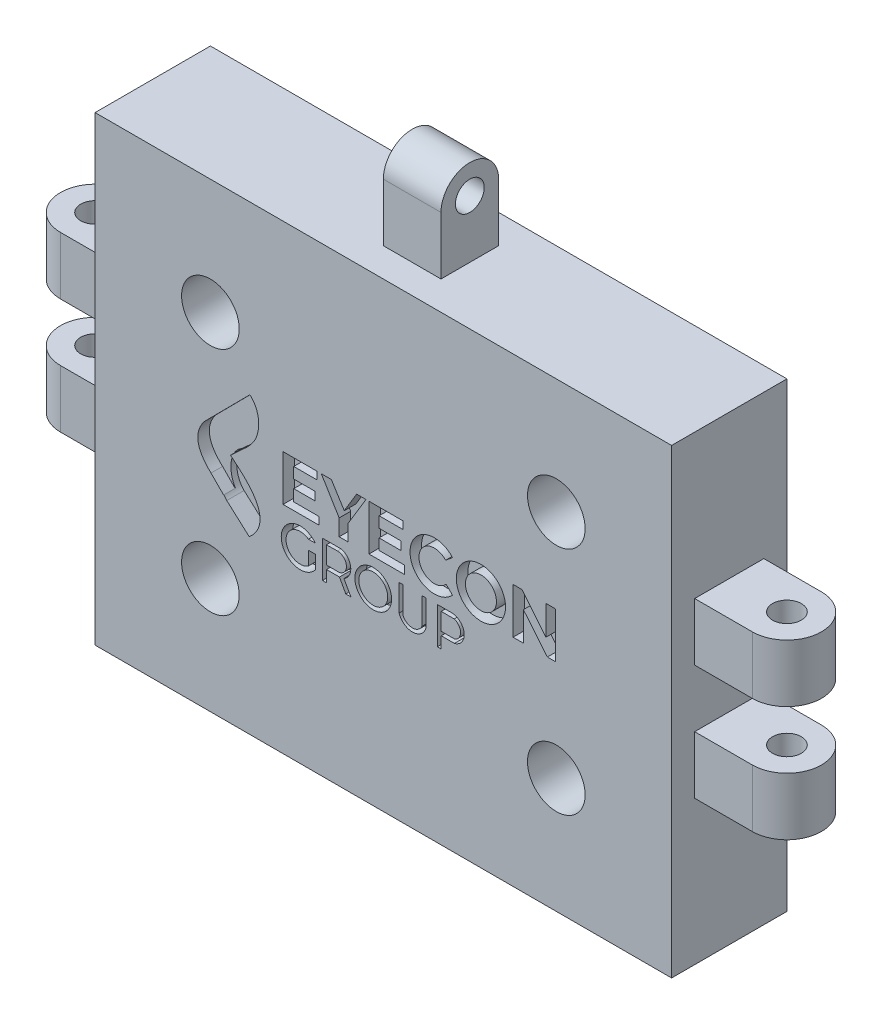
from build123d import *

# Parameters (mm, degrees)
SKETCH1_W           = 50
SKETCH1_H           = 40
BOSS_EXTRUDE1_DEPTH = 10
SKETCH5_W           = 6
SKETCH5_H           = 5
BOSS_EXTRUDE3_DEPTH = 10
SKETCH6_R           = 1.25
CUT_EXTRUDE1_DEPTH  = 20
SKETCH8_W           = 10
SKETCH8_H           = 40
CUT_EXTRUDE2_DEPTH  = 25
SKETCH12_W          = 5
SKETCH12_H          = 5
BOSS_EXTRUDE5_DEPTH = 10
SKETCH13_R          = 1.25
CUT_EXTRUDE4_DEPTH  = 10
SKETCH14_R          = 2.5
CUT_EXTRUDE5_DEPTH  = 10
CUT_EXTRUDE6_DEPTH  = 22
CUT_EXTRUDE7_DEPTH  = 30
CUT_EXTRUDE8_DEPTH  = 30
SCALE1_SCALE        = 2
CUT_EXTRUDE31_DEPTH = 2
SKETCH24_R          = 4.266796814
SKETCH24_R_2        = 2.690088412
CUT_EXTRUDE32_DEPTH = 2
SKETCH25_R          = 3.182411807
SKETCH25_R_2        = 2.505398091
CUT_EXTRUDE33_DEPTH = 2
CUT_EXTRUDE34_DEPTH = 3


with BuildPart() as part:
    # Sketch1 → Boss-Extrude1 (new body)
    with BuildSketch(Plane(origin=(669.84184187, 0, 0), x_dir=(1, 0, 0), z_dir=(0, 0, 1))):
        with Locations((-671.310344828, 437.637931034)):
            Rectangle(SKETCH1_W, SKETCH1_H)
    boss_extrude1 = extrude(amount=BOSS_EXTRUDE1_DEPTH)

    # Sketch5 → Boss-Extrude3 (add)
    with BuildSketch(Plane(origin=(23.531497042, 0, 0), x_dir=(0, 0, -1), z_dir=(1, 0, 0))):
        with Locations((-5, 442.637931034)):
            Rectangle(SKETCH5_W, SKETCH5_H)
        with Locations((-5, 432.637931034)):
            Rectangle(SKETCH5_W, SKETCH5_H)
    boss_extrude3 = extrude(amount=BOSS_EXTRUDE3_DEPTH)

    # Sketch6 → Cut-Extrude1 (cut)
    with BuildSketch(Plane(origin=(669.84184187, 445.137931034, 0), x_dir=(1, 0, 0), z_dir=(0, 1, 0))):
        with Locations(Location((-641.310344828, -5, 0), (0, 0, 180))):
            Circle(SKETCH6_R)
    cut_extrude1 = extrude(amount=-CUT_EXTRUDE1_DEPTH, mode=Mode.SUBTRACT)

    # Sketch8 → Cut-Extrude2 (cut)
    with BuildSketch(Plane.ZY.offset(26.468502958)):
        with Locations((5, 437.637931034)):
            Rectangle(SKETCH8_W, SKETCH8_H)
    extrude(amount=-CUT_EXTRUDE2_DEPTH, mode=Mode.SUBTRACT)

    # Mirror1: Boss-Extrude1, Boss-Extrude3, Cut-Extrude1 across plane
    add(boss_extrude1.mirror(Plane(origin=(-1.468502958, 0, 0), x_dir=(0, 0, 1), z_dir=(1, 0, 0))))
    add(boss_extrude3.mirror(Plane(origin=(-1.468502958, 0, 0), x_dir=(0, 0, 1), z_dir=(1, 0, 0))))
    add(cut_extrude1.mirror(Plane(origin=(-1.468502958, 0, 0), x_dir=(0, 0, 1), z_dir=(1, 0, 0))), mode=Mode.SUBTRACT)

    # Sketch12 → Boss-Extrude5 (add)
    with BuildSketch(Plane(origin=(0, 457.637931034, 0), x_dir=(1, 0, 0), z_dir=(0, 1, 0))):
        with Locations((-1.468502958, -5)):
            Rectangle(SKETCH12_W, SKETCH12_H)
    extrude(amount=BOSS_EXTRUDE5_DEPTH)

    # Sketch13 → Cut-Extrude4 (cut)
    with BuildSketch(Plane(origin=(1.031497042, 0, 0), x_dir=(0, 0, -1), z_dir=(1, 0, 0))):
        with Locations((-5, 462.637931034)):
            Circle(SKETCH13_R)
    extrude(amount=-CUT_EXTRUDE4_DEPTH, mode=Mode.SUBTRACT)

    # Sketch14 → Cut-Extrude5 (cut)
    with BuildSketch(Plane.XY.offset(10)):
        with Locations((-16.468502958, 447.637931034)):
            Circle(SKETCH14_R)
        with Locations((-16.468502958, 427.637931034)):
            Circle(SKETCH14_R)
        with Locations((13.531497042, 447.637931034)):
            Circle(SKETCH14_R)
        with Locations((13.531497042, 427.637931034)):
            Circle(SKETCH14_R)
    extrude(amount=-CUT_EXTRUDE5_DEPTH, mode=Mode.SUBTRACT)

    # Sketch15 → Cut-Extrude6 (cut)
    with BuildSketch(Plane(origin=(0, 445.137931034, 0), x_dir=(1, 0, 0), z_dir=(0, 1, 0))):
        with BuildLine():
            Line((33.531497042, -2), (28.531497042, -2))
            ThreePointArc((28.531497042, -2), (30.652817386, -2.878679656), (31.531497042, -5))
            ThreePointArc((31.531497042, -5), (30.652817386, -7.121320344), (28.531497042, -8))
            Line((28.531497042, -8), (33.531497042, -8))
            Line((33.531497042, -8), (33.531497042, -2))
        make_face()
    extrude(amount=-CUT_EXTRUDE6_DEPTH, mode=Mode.SUBTRACT)

    # Sketch17 → Cut-Extrude7 (cut)
    with BuildSketch(Plane(origin=(0, 445.137931034, 0), x_dir=(1, 0, 0), z_dir=(0, 1, 0))):
        with BuildLine():
            Line((-36.468502958, -8), (-31.468502958, -8))
            ThreePointArc((-31.468502958, -8), (-34.468502958, -5), (-31.468502958, -2))
            Line((-31.468502958, -2), (-36.468502958, -2))
            Line((-36.468502958, -2), (-36.468502958, -8))
        make_face()
    extrude(amount=-CUT_EXTRUDE7_DEPTH, mode=Mode.SUBTRACT)

    # Sketch18 → Cut-Extrude8 (cut)
    with BuildSketch(Plane(origin=(1.031497042, 0, 0), x_dir=(0, 0, -1), z_dir=(1, 0, 0))):
        with BuildLine():
            Line((-7.5, 467.637931034), (-7.5, 462.637931034))
            ThreePointArc((-7.5, 462.637931034), (-5, 465.137931034), (-2.5, 462.637931034))
            Line((-2.5, 462.637931034), (-2.5, 467.637931034))
            Line((-2.5, 467.637931034), (-7.5, 467.637931034))
        make_face()
    extrude(amount=-CUT_EXTRUDE8_DEPTH, mode=Mode.SUBTRACT)


with BuildPart() as part_1:
    # Scale1: scaled about (-1.468502958, 437.810556227, 5)
    add(part.part.scale(SCALE1_SCALE).moved(Location((1.468502958, -437.810556227, -5))))

    # Sketch21 → Cut-Extrude31 (cut)
    with BuildSketch(Plane.XY.offset(15)):
        with BuildLine():
            Line((-31.359227607, 433.374239798), (-29.177251522, 431.169484661))
            Line((-29.177251522, 431.169484661), (-29.052385686, 431.29306041))
            add(Edge.make_bspline(
                [(-28.613813156, 436.973234913), (-30.855344904, 434.468510352), (-29.052385686, 431.29306041)],
                knots=[0, 0, 0, 0.903685065, 0.903685065, 0.903685065], degree=2))
            add(Edge.make_bspline(
                [(-24.610088794, 448.513250115), (-22.791340342, 446.852336273), (-22.620182569, 441.200883978), (-27.228961405, 438.87676902), (-28.613813156, 436.973234913)],
                knots=[0, 0, 0, 0, 0.489899717, 1, 1, 1, 1], degree=3))
            Line((-24.610088794, 448.513250115), (-32.55457583, 440.495700159))
            add(Edge.make_bspline(
                [(-32.55457583, 440.495700159), (-35.244245053, 436.973213203), (-31.359227607, 433.374239798)],
                knots=[0, 0, 0, 1, 1, 1], degree=2))
        make_face()
    extrude(amount=-CUT_EXTRUDE31_DEPTH, mode=Mode.SUBTRACT)

    # Sketch24 → Cut-Extrude32 (cut)
    # profile 1 of 6: a face of its own
    with BuildSketch(Plane.XY.offset(15)):
        Polygon((-12.936135732, 442.838813833), (-18.857316801, 442.838813833), (-18.857316801, 434.907690568), (-12.628306747, 434.907690568), (-12.628306747, 436.211436858), (-17.010342889, 436.211436858), (-17.010342889, 438.203271468), (-13.29828748, 438.203271468), (-13.29828748, 439.651878457), (-17.010342889, 439.651878457), (-17.010342889, 441.535067543), (-12.936135732, 441.535067543), align=None)
    # profile 2 of 6: a face of its own
    with BuildSketch(Plane.XY.offset(15)):
        Polygon((-10.491611438, 442.838813833), (-12.229939825, 442.838813833), (-9.133542386, 437.738001506), (-9.133542386, 434.907690568), (-7.561093788, 434.907690568), (-7.561093788, 437.738001506), (-4.479892433, 442.838813833), (-6.091467709, 442.838813833), (-8.246270605, 439.271619122), align=None)
    # profile 3 of 6: a face of its own
    with BuildSketch(Plane.XY.offset(15)):
        Polygon((1.980454186, 442.838813833), (-3.96245358, 442.838813833), (-3.96245358, 434.907690568), (2.226792332, 434.907690568), (2.226792332, 436.322846037), (-2.207294292, 436.322846037), (-2.207294292, 438.203271468), (1.582497384, 438.203271468), (1.582497384, 439.651878457), (-2.207294292, 439.651878457), (-2.207294292, 441.535067543), (1.980454186, 441.535067543), align=None)
    # profile 4 of 6: a face of its own
    with BuildSketch(Plane.XY.offset(15)):
        Polygon((22.577423514, 442.838813833), (21.033668764, 442.838813833), (21.033668764, 434.907690568), (22.826416216, 434.907690568), (22.826416216, 439.948582703), (26.984594334, 434.907690568), (28.403852734, 434.907690568), (28.403852734, 442.838813833), (26.710702362, 442.838813833), (26.710702362, 437.738001506), align=None)
    # profile 5 of 6: a face of its own
    with BuildSketch(Plane.XY.offset(15)):
        with BuildLine():
            ThreePointArc((9.417782034, 437.070057734), (4.708113195, 438.734286076), (9.333589322, 440.61991784))
            Line((9.333589322, 440.61991784), (10.52761916, 441.616098256))
            ThreePointArc((10.52761916, 441.616098256), (3.153844431, 438.80435494), (10.518646647, 435.969193121))
            Line((10.518646647, 435.969193121), (9.417782034, 437.070057734))
        make_face()
    # profile 6 of 6: a face of its own
    with BuildSketch(Plane.XY.offset(15)):
        with Locations((15.458843544, 438.797640887)):
            Circle(SKETCH24_R)
        with Locations((15.458843544, 438.797640887)):
            Circle(SKETCH24_R_2, mode=Mode.SUBTRACT)
    extrude(amount=-CUT_EXTRUDE32_DEPTH, mode=Mode.SUBTRACT)

    # Sketch25 → Cut-Extrude33 (cut)
    # profile 1 of 5: a face of its own
    with BuildSketch(Plane.XY.offset(15)):
        with BuildLine():
            ThreePointArc((-13.276881846, 431.890209471), (-19.178932325, 429.874384738), (-13.276881846, 427.858560005))
            Line((-13.276881846, 427.858560005), (-13.276881846, 430.229603415))
            Line((-13.276881846, 430.229603415), (-14.46404323, 430.229603415))
            Line((-14.46404323, 430.229603415), (-14.46404323, 427.858560005))
            ThreePointArc((-14.46404323, 427.858560005), (-18.349191716, 429.874384738), (-14.46404323, 431.890209471))
            Line((-14.46404323, 431.890209471), (-13.276881846, 431.890209471))
        make_face()
    # profile 2 of 5: a face of its own
    with BuildSketch(Plane.XY.offset(15)):
        with BuildLine():
            Line((-8.679110401, 433.257976432), (-12.020840704, 433.257976432))
            Line((-12.020840704, 433.257976432), (-12.020840704, 426.897044958))
            Line((-12.020840704, 426.897044958), (-11.336361993, 426.897044958))
            Line((-11.336361993, 426.897044958), (-11.336361993, 428.891474307))
            Line((-11.336361993, 428.891474307), (-9.082302788, 428.891474307))
            Line((-9.082302788, 428.891474307), (-7.984776578, 426.897044958))
            Line((-7.984776578, 426.897044958), (-7.099674796, 426.897044958))
            Line((-7.099674796, 426.897044958), (-8.308442263, 429.061837603))
            ThreePointArc((-8.308442263, 429.061837603), (-7.126128883, 431.280718877), (-8.679110401, 433.257976432))
        make_face()
        with BuildLine():
            Line((-11.336361993, 429.565125179), (-11.336361993, 432.608901792))
            Line((-11.336361993, 432.608901792), (-9.419247193, 432.629199169))
            ThreePointArc((-9.419247193, 432.629199169), (-7.877735937, 431.249855005), (-9.07795787, 429.565125179))
            Line((-9.07795787, 429.565125179), (-11.336361993, 429.565125179))
        make_face(mode=Mode.SUBTRACT)
    # profile 3 of 5: a face of its own
    with BuildSketch(Plane.XY.offset(15)):
        with BuildLine():
            Line((1.927575724, 433.257976432), (1.265210024, 433.257976432))
            Line((1.265210024, 433.257976432), (1.265210024, 428.651785914))
            ThreePointArc((1.265210024, 428.651785914), (3.560087537, 426.960211879), (5.887040157, 428.607384312))
            Line((5.887040157, 428.607384312), (5.887040157, 433.257976432))
            Line((5.887040157, 433.257976432), (5.239369495, 433.257976432))
            Line((5.239369495, 433.257976432), (5.239369495, 428.651785914))
            ThreePointArc((5.239369495, 428.651785914), (3.583472609, 427.579607678), (1.927575724, 428.651785914))
            Line((1.927575724, 428.651785914), (1.927575724, 433.257976432))
        make_face()
    # profile 4 of 5: a face of its own
    with BuildSketch(Plane.XY.offset(15)):
        with BuildLine():
            Line((10.340189816, 433.257976432), (7.89381302, 433.257976432))
            Line((7.89381302, 433.257976432), (7.89381302, 426.897044958))
            Line((7.89381302, 426.897044958), (8.570850647, 426.897044958))
            Line((8.570850647, 426.897044958), (8.570850647, 428.891474307))
            Line((8.570850647, 428.891474307), (10.861492454, 428.88852013))
            ThreePointArc((10.861492454, 428.88852013), (12.540411669, 431.30465081), (10.340189816, 433.257976432))
        make_face()
        with BuildLine():
            Line((10.91303487, 429.564151662), (8.570850647, 429.564151662))
            Line((8.570850647, 429.564151662), (8.570850647, 432.552426575))
            Line((8.570850647, 432.552426575), (10.821543299, 432.552426575))
            ThreePointArc((10.821543299, 432.552426575), (11.924576252, 431.090659923), (10.91303487, 429.564151662))
        make_face(mode=Mode.SUBTRACT)
    # profile 5 of 5: a face of its own
    with BuildSketch(Plane.XY.offset(15)):
        with Locations((-3.219937476, 430.075564625)):
            Circle(SKETCH25_R)
        with Locations((-3.219937476, 430.075564625)):
            Circle(SKETCH25_R_2, mode=Mode.SUBTRACT)
    extrude(amount=-CUT_EXTRUDE33_DEPTH, mode=Mode.SUBTRACT)

    # Sketch37 → Cut-Extrude34 (cut)
    with BuildSketch(Plane.XY.offset(15)):
        with BuildLine():
            Line((-28.622123434, 430.608561233), (-24.723469474, 427.115831873))
            add(Edge.make_bspline(
                [(-27.982734947, 437.733446551), (-25.113467793, 435.443376381), (-20.118028269, 431.211278232), (-24.723469474, 427.115831873)],
                knots=[0, 0, 0, 0, 1, 1, 1, 1], degree=3))
            add(Edge.make_bspline(
                [(-27.982734947, 437.733446551), (-30.364083053, 436.505708646), (-30.491678834, 432.47370287), (-28.622123434, 430.608561233)],
                knots=[0, 0, 0, 0, 1, 1, 1, 1], degree=3))
        make_face()
    extrude(amount=-CUT_EXTRUDE34_DEPTH, mode=Mode.SUBTRACT)


solid = part_1.part
